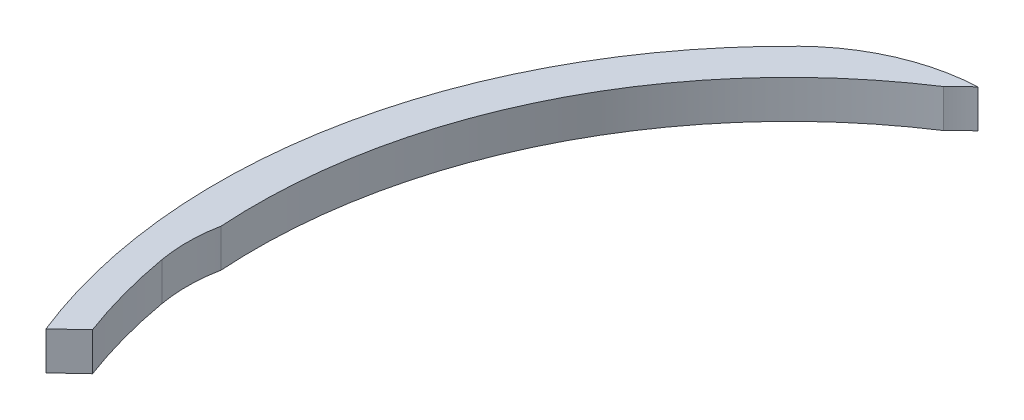
from build123d import *

# Parameters (mm, degrees)
BOSS_EXTRU_1_DEPTH = 5


with BuildPart() as part:
    # Esquisse1 → Boss.-Extru.1 (new body)
    with BuildSketch(Plane(origin=(0, 0, 0), x_dir=(1, 0, 0), z_dir=(0, 1, 0))):
        with BuildLine():
            Line((-85.986477301, -39.220909897), (-82.836538311, -36.274742561))
            ThreePointArc((-82.836538311, -36.274742561), (-84.826589539, -30.099452785), (-86.244619049, -23.768283856))
            ThreePointArc((-86.244619049, -23.768283856), (-86.563047935, -19.917311272), (-86.17049139, -16.073187685))
            ThreePointArc((-86.17049139, -16.073187685), (-78.973775537, 19.793847734), (-54.666943907, 47.13273734))
            ThreePointArc((-54.666943907, 47.13273734), (-53.551106318, 48.285581279), (-52.350511604, 49.349872124))
            ThreePointArc((-52.350511604, 49.349872124), (-61.160452612, 47.314883556), (-68.670306383, 42.279177512))
            ThreePointArc((-68.670306383, 42.279177512), (-89.686895205, 4.154921869), (-85.986477301, -39.220909897))
        make_face()
    extrude(amount=BOSS_EXTRU_1_DEPTH)


solid = part.part
